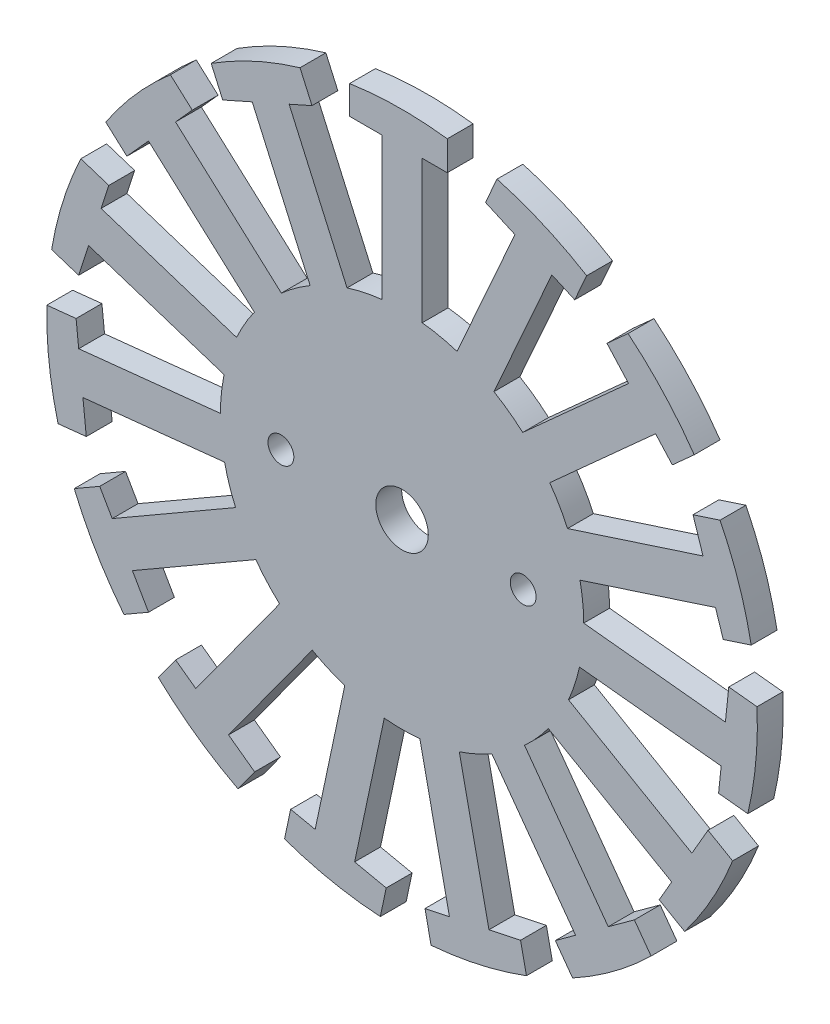
from build123d import *

# Parameters (mm, degrees)
SKETCH_1_R               = 22.5
EXTRUDE_2_DEPTH          = 3.2
PATTERN_CIRCULAR_2_COUNT = 15
SKETCH_3_R               = 3.25
CUT_EXTRUDE_2_DEPTH      = 3.2
SKETCH_5_R               = 1.6
CUT_EXTRUDE_3_DEPTH      = 10


with BuildPart() as part:
    # ｽｹｯﾁ1 → ﾎﾞｽ - 押し出し2 (new body)
    with BuildSketch(Plane.XY):
        Circle(SKETCH_1_R)
        with BuildLine():
            Line((0, 0), (-2.5, 0))
            Line((-2.5, 0), (-2.5, 40))
            Line((-2.5, 40), (-6.5, 40))
            Line((-6.5, 40), (-6.5, 43.517237964))
            ThreePointArc((-6.5, 43.517237964), (-0.454315658, 43.997654452), (5.6, 43.64218143))
            Line((5.6, 43.64218143), (5.6, 40))
            Line((5.6, 40), (2.5, 40))
            Line((2.5, 40), (2.5, 0))
            Line((2.5, 0), (0, 0))
        make_face()
    extrude_2 = extrude(amount=EXTRUDE_2_DEPTH)

    # 円形ﾊﾟﾀｰﾝ2: ﾎﾞｽ - 押し出し2 ×15 about axis
    pattern_circular_2_axis = Axis((0, 0, 0), (0, 0, 1))
    for i in range(1, PATTERN_CIRCULAR_2_COUNT):
        add(extrude_2.rotate(pattern_circular_2_axis, i * 360 / PATTERN_CIRCULAR_2_COUNT))

    # ｽｹｯﾁ3 → ｶｯﾄ - 押し出し2 (cut)
    with BuildSketch(Plane.XY.offset(3.2)):
        Circle(SKETCH_3_R)
    extrude(amount=-CUT_EXTRUDE_2_DEPTH, mode=Mode.SUBTRACT)

    # ｽｹｯﾁ5 → ｶｯﾄ - 押し出し3 (cut)
    with BuildSketch(Plane.XY.offset(3.2)):
        with Locations((-15, 0)):
            Circle(SKETCH_5_R)
        with Locations((15, 0)):
            Circle(SKETCH_5_R)
    extrude(amount=-CUT_EXTRUDE_3_DEPTH, mode=Mode.SUBTRACT)


solid = part.part
